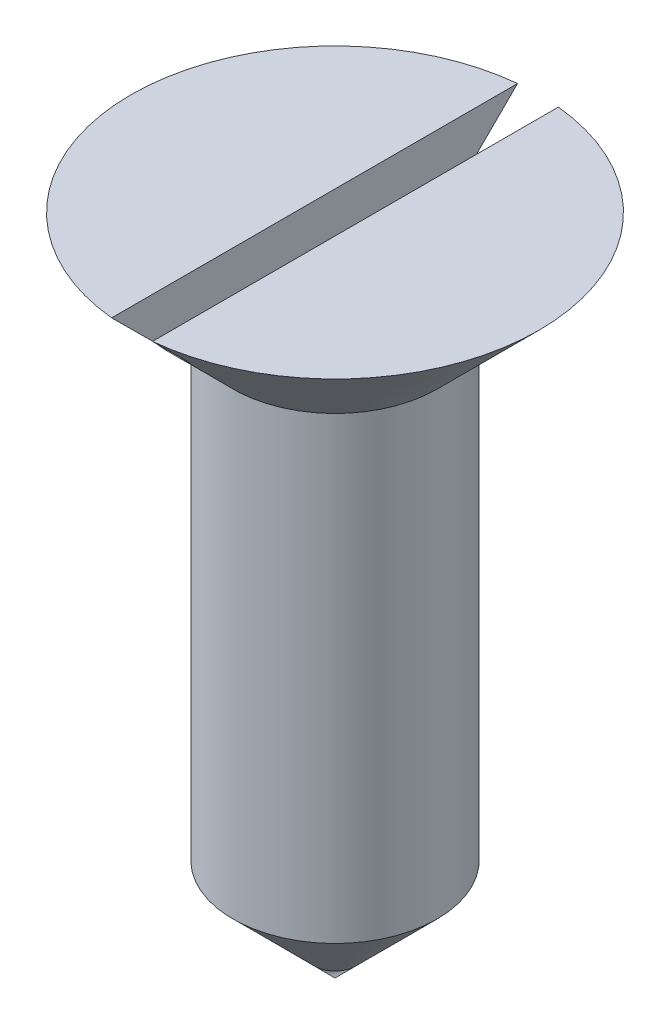
from build123d import *

# Parameters (mm, degrees)
CUT_EXTRUDE1_DEPTH      = 43.532340636
CUT_EXTRUDE1_DEPTH_BACK = 43.532340636
SKETCH2_W               = 2.4
SKETCH2_H               = 2.4


with BuildPart() as part:
    # Sketch1 → Revolve1 (revolve)
    with BuildSketch(Plane.XY, mode=Mode.PRIVATE) as revolve1_sk:
        Polygon((0, 0), (6, 6), (6, 33), (12, 39), (0, 39), align=None)
    revolve(revolve1_sk.sketch.rotate(Axis((0, 39, 0), (0, -1, 0)), 180), axis=Axis((0, 39, 0), (0, -1, 0)))

    # Sketch2 → Cut-Extrude1 (cut, two sides: drawn at the far end of the back side and taken through both)
    with BuildSketch(Plane.XY.offset(-CUT_EXTRUDE1_DEPTH_BACK)):
        with Locations((0, 37.8)):
            Rectangle(SKETCH2_W, SKETCH2_H)
    extrude(amount=CUT_EXTRUDE1_DEPTH + CUT_EXTRUDE1_DEPTH_BACK, mode=Mode.SUBTRACT)


solid = part.part
